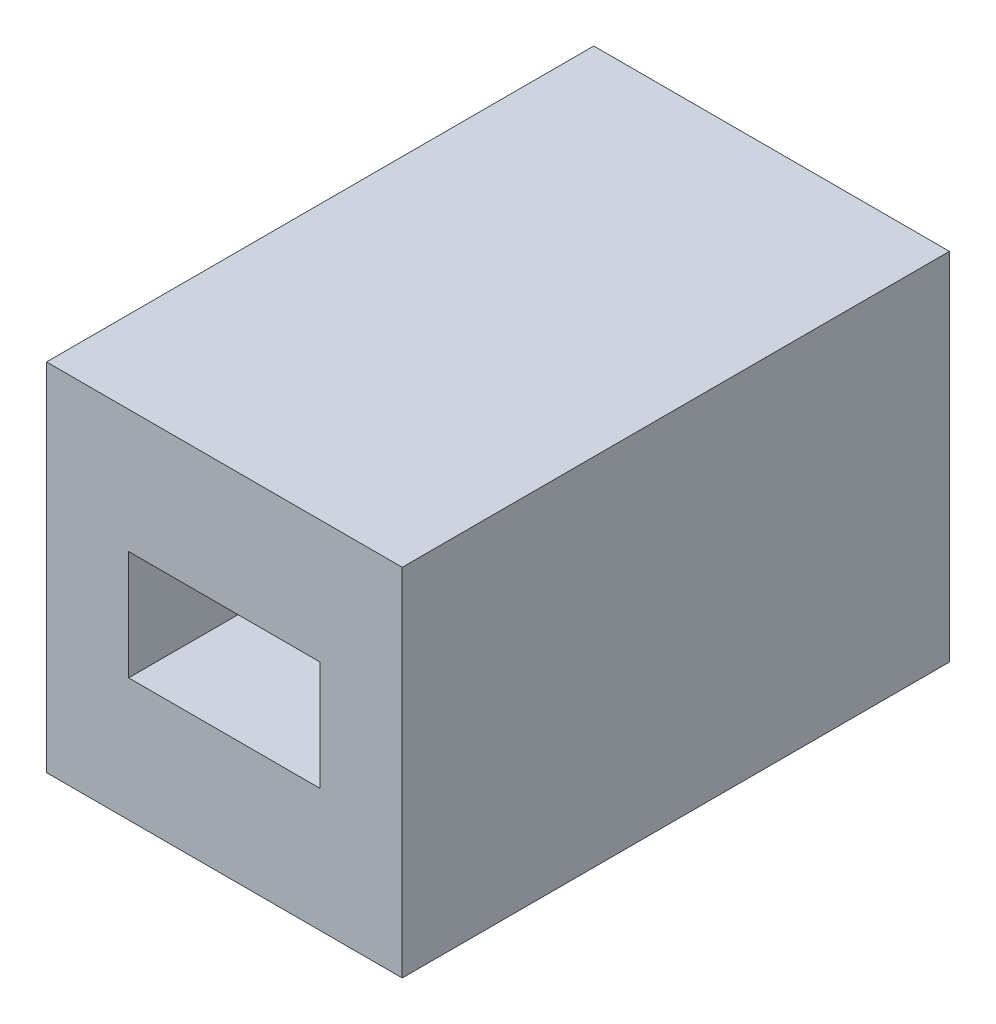
from build123d import *

# Parameters (mm, degrees)
SKETCH_1_W      = 130
SKETCH_1_H      = 130
SKETCH_1_W_2    = 70
SKETCH_1_H_2    = 40
EXTRUDE_1_DEPTH = 200


with BuildPart() as part:
    # 스케치1 → 보스-돌출1 (new body)
    with BuildSketch(Plane.XY):
        Rectangle(SKETCH_1_W, SKETCH_1_H)
        Rectangle(SKETCH_1_W_2, SKETCH_1_H_2, mode=Mode.SUBTRACT)
    extrude(amount=EXTRUDE_1_DEPTH)


solid = part.part
